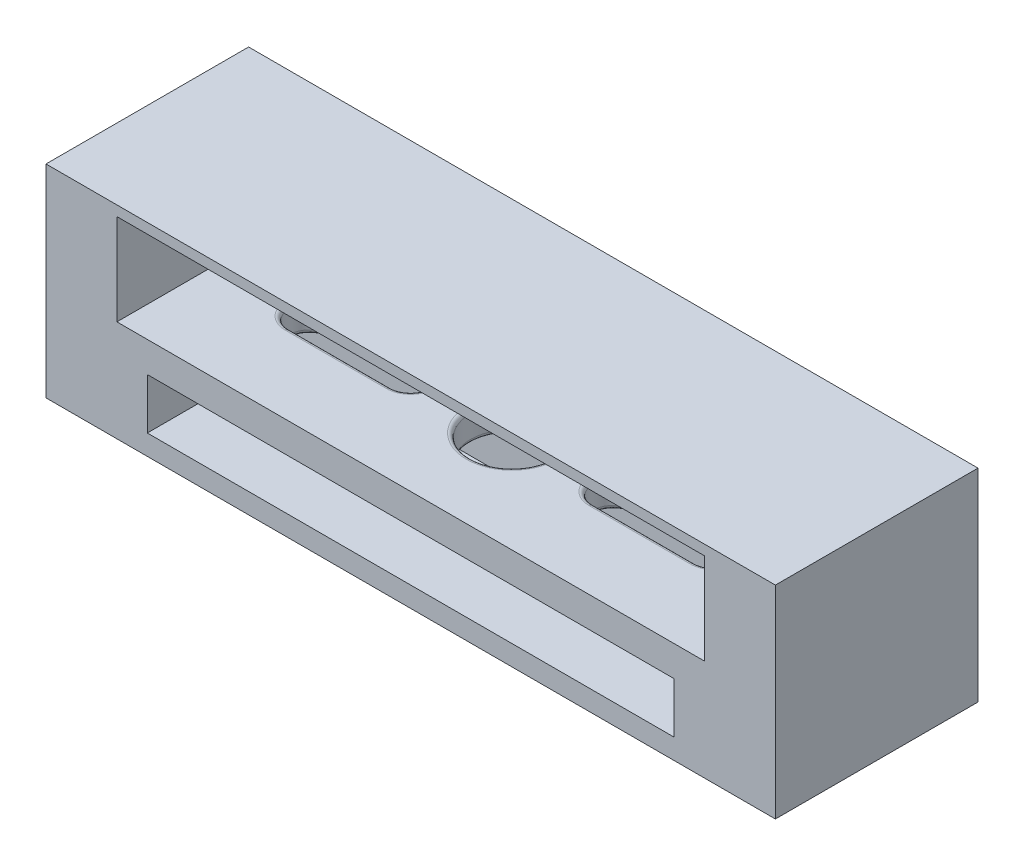
from build123d import *

# Parameters (mm, degrees)
SKETCH_1_W          = 360
SKETCH_1_H          = 100
EXTRUDE_1_DEPTH     = 50
CUT_EXTRUDE_1_DEPTH = 40
SKETCH_3_W          = 260
SKETCH_3_H          = 25
CUT_EXTRUDE_2_DEPTH = 70
SKETCH_4_R          = 20.5
CUT_EXTRUDE_3_DEPTH = 20
FILLET_4_R          = 2
SKETCH_6_W          = 35
SKETCH_6_H          = 100
EXTRUDE_2_DEPTH     = 45
SKETCH_7_W          = 360
SKETCH_7_H          = 100
EXTRUDE_3_DEPTH     = 5


with BuildPart() as part:
    # 草图1 → 凸台-拉伸1 (new body)
    with BuildSketch(Plane(origin=(0, 0, 0), x_dir=(1, 0, 0), z_dir=(0, 1, 0))):
        with Locations((180, -50)):
            Rectangle(SKETCH_1_W, SKETCH_1_H)
    extrude(amount=EXTRUDE_1_DEPTH)

    # 草图2 → 切除-拉伸1 (cut)
    with BuildSketch(Plane(origin=(0, 50, 0), x_dir=(1, 0, 0), z_dir=(0, 1, 0))):
        with BuildLine():
            Line((80, -40), (130, -40))
            ThreePointArc((130, -40), (140, -50), (130, -60))
            Line((130, -60), (80, -60))
            ThreePointArc((80, -60), (70, -50), (80, -40))
        make_face()
        with BuildLine():
            Line((230, -40), (280, -40))
            ThreePointArc((280, -40), (290, -50), (280, -60))
            Line((280, -60), (230, -60))
            ThreePointArc((230, -60), (220, -50), (230, -40))
        make_face()
    extrude(amount=-CUT_EXTRUDE_1_DEPTH, mode=Mode.SUBTRACT)

    # 草图3 → 切除-拉伸2 (cut)
    with BuildSketch(Plane.XY.offset(100)):
        with Locations((180, 22.5)):
            Rectangle(SKETCH_3_W, SKETCH_3_H)
    extrude(amount=-CUT_EXTRUDE_2_DEPTH, mode=Mode.SUBTRACT)

    # 草图4 → 切除-拉伸3 (cut)
    with BuildSketch(Plane(origin=(0, 50, 0), x_dir=(1, 0, 0), z_dir=(0, 1, 0))):
        with Locations(Location((180, -50, 0), (0, 0, 270))):
            Circle(SKETCH_4_R)
    extrude(amount=-CUT_EXTRUDE_3_DEPTH, mode=Mode.SUBTRACT)

    # 圆角4
    fillet_4_edges = [part.edges().sort_by_distance(p)[0] for p in [
        (70, 50, 50),
        (105, 50, 60),
        (140, 50, 50),
        (105, 50, 40),
        (220, 50, 50),
        (255, 50, 60),
        (290, 50, 50),
        (255, 50, 40),
        (105, 35, 60),
        (70, 35, 50),
        (105, 35, 40),
        (140, 35, 50),
        (255, 35, 60),
        (220, 35, 50),
        (255, 35, 40),
        (290, 35, 50),
        (184.5, 32.5, 30),
        (175.5, 32.5, 30),
        (159.625383439, 35, 52.263846285),
        (180, 50, 29.5),
    ]]
    fillet(fillet_4_edges, radius=FILLET_4_R)

    # 草图6 → 凸台-拉伸2 (add)
    with BuildSketch(Plane(origin=(0, 50, 0), x_dir=(1, 0, 0), z_dir=(0, 1, 0))):
        with Locations((342.5, -50)):
            Rectangle(SKETCH_6_W, SKETCH_6_H)
        with Locations((17.5, -50)):
            Rectangle(SKETCH_6_W, SKETCH_6_H)
    extrude(amount=EXTRUDE_2_DEPTH)

    # 草图7 → 凸台-拉伸3 (add)
    with BuildSketch(Plane(origin=(0, 95, 0), x_dir=(1, 0, 0), z_dir=(0, 1, 0))):
        with Locations((180, -50)):
            Rectangle(SKETCH_7_W, SKETCH_7_H)
    extrude(amount=EXTRUDE_3_DEPTH)


solid = part.part
